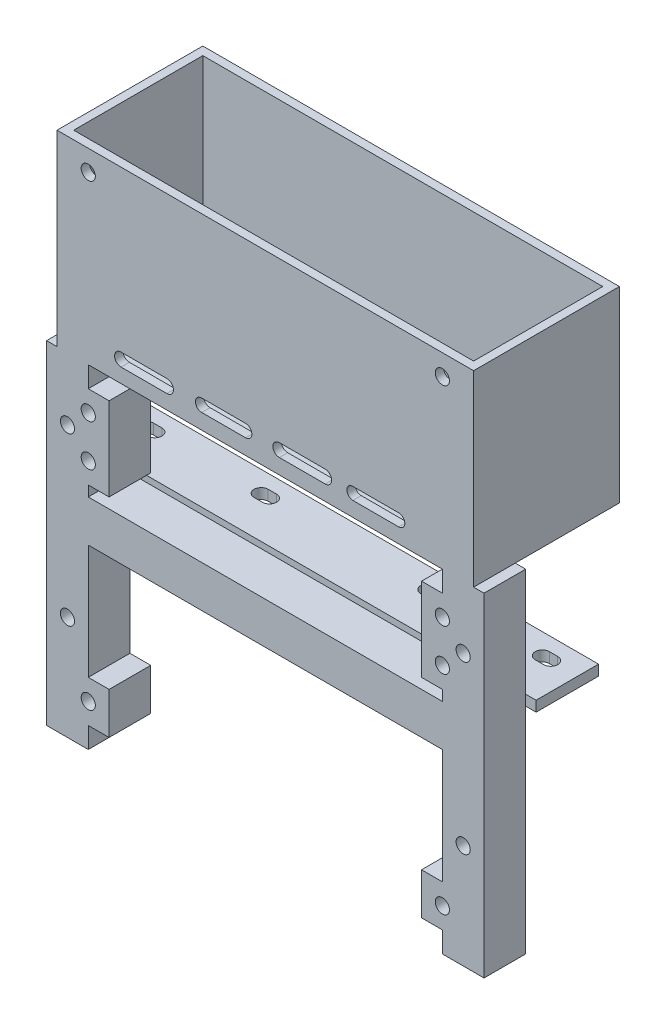
from build123d import *

# Parameters (mm, degrees)
V3_BOX_FOOTPRINT_100_X_45_MM_W                 = 100
V3_BOX_FOOTPRINT_100_X_45_MM_H                 = 45
V3_BOX_HEIGHT_35_MM_DEPTH                      = 35
V3_REAR_OPENING_96_X_31_MM_W                   = 96
V3_REAR_OPENING_96_X_31_MM_H                   = 31
V3_CAVITY_ALL_WALLS_2_MM_DEPTH                 = 43
V3_SQUARE_BEAMS_10_X_10_PITCH_95_MM_W          = 10
V3_SQUARE_BEAMS_10_X_10_PITCH_95_MM_H          = 10
V3_FORWARD_BEAM_LENGTH_65_MM_DEPTH             = 65
V3_LEFT_PCB_EAR_PROFILE_W                      = 10
V3_LEFT_PCB_EAR_PROFILE_H                      = 10
V3_LEFT_INWARD_EAR_5_MM_DEPTH                  = 5
V3_RIGHT_PCB_EAR_PROFILE_W                     = 10
V3_RIGHT_PCB_EAR_PROFILE_H                     = 10
V3_RIGHT_INWARD_EAR_5_MM_DEPTH                 = 5
V3_PCB_ROOF_PAIR_PITCH_85_MM_R                 = 1.7
V3_M3_ROOF_HOLES_DIAMETER_3_4_MM_DEPTH         = 2
V3_PCB_FORWARD_PAIR_ROW_SPACING_60_MM_R        = 1.7
V3_M3_PCB_EAR_HOLES_DEPTH                      = 10
V3_CHASSIS_TOP_HOLES_WIDTH_95_DEPTH_40_M_R     = 1.7
V3_M3_BEAM_TOP_BOTTOM_HOLES_DEPTH              = 10
V3_HANGING_PLATE_OFFSET_26_THICKNESS_2_5_W     = 110
V3_HANGING_PLATE_OFFSET_26_THICKNESS_2_5_H     = 2.5
V3_MOUNTING_PLATE_DOWNWARD_15_MM_WIDTH_1_DEPTH = 15
FOUR_HORIZONTAL_SLOTS_3_4_X_5_4_MM_DEPTH       = 2.5
CUT_EXTRUDE_1_DEPTH                            = 93.059763198
H_CROSSMEMBER_10_X_10_MM_AT_BEAM_MIDPOIN_W     = 10
H_CROSSMEMBER_10_X_10_MM_AT_BEAM_MIDPOIN_H     = 10
H_CROSSMEMBER_85_MM_DEPTH                      = 85
LONGITUDINAL_START                             = -2
BEAM_CAVITIES_6_MM_WIDE_PRESERVING_SCREW_W     = 6
BEAM_CAVITIES_6_MM_WIDE_PRESERVING_SCREW_H     = 6
BEAM_CAVITIES_6_MM_WIDE_PRESERVING_SCREW_H_2   = 27
BEAM_CAVITIES_6_MM_WIDE_PRESERVING_SCREW_H_3   = 9
LONGITUDINAL_BEAM_WALLS_2_MM_INNER_HEI_DEPTH   = 6
H_START                                        = -2
H_CROSSMEMBER_CAVITY_CONNECTS_BOTH_BEAM_W      = 89
H_CROSSMEMBER_CAVITY_CONNECTS_BOTH_BEAM_H      = 6
H_CROSSMEMBER_WALLS_2_MM_DEPTH                 = 6
CUT_EXTRUDE_4_DEPTH                            = 93.059763198
V6_EXTEND_10_X_10_HOLLOW_BEAMS_WITH_2_MM_W     = 10
V6_EXTEND_10_X_10_HOLLOW_BEAMS_WITH_2_MM_H     = 10
V6_EXTEND_10_X_10_HOLLOW_BEAMS_WITH_2_MM_W_2   = 6
V6_EXTEND_10_X_10_HOLLOW_BEAMS_WITH_2_MM_H_2   = 6
V6_HOLLOW_BEAM_EXTENSIONS_15_MM_DEPTH          = 15
V6_FOUR_FULL_DEPTH_PCB_PADS_CENTERS_X42_W      = 15
V6_FOUR_FULL_DEPTH_PCB_PADS_CENTERS_X42_H      = 10
V6_SOLID_SCREW_PADS_WITH_5_MM_INWARD_EAR_DEPTH = 10
V6_PCB_HOLES_85_X_60_MM_AND_RETAINED_CHA_R     = 1.7
V6_FOUR_PCB_M3_HOLES_THROUGH_REINFORCED_DEPTH  = 10
V7_RETAIN_RAIL_ENVELOPES_10_X_10_LENGTH_W      = 10
V7_RETAIN_RAIL_ENVELOPES_10_X_10_LENGTH_H      = 80
V7_SOLID_LONGITUDINAL_BEAMS_DEPTH              = 10
V7_RETAIN_H_CROSSMEMBER_ENVELOPE_W             = 85
V7_RETAIN_H_CROSSMEMBER_ENVELOPE_H             = 10
V7_SOLID_H_CROSSMEMBER_DEPTH                   = 10
V7_PRESERVE_ALL_TEN_EXISTING_BEAM_M3_BOR_R     = 1.7
V7_RESTORE_CHASSIS_AND_PCB_CLEARANCE_BOR_DEPTH = 10
V7_REFILL_OLD_MOUNTING_SLOTS_WITHIN_UNCH_W     = 110
V7_REFILL_OLD_MOUNTING_SLOTS_WITHIN_UNCH_H     = 15
V7_CLOSE_PREVIOUS_SLOT_POSITIONS_DEPTH         = 2.5
V7_FOUR_HORIZONTAL_SLOTS_3_4_X_5_4_MM_AT_DEPTH = 2.5


with BuildPart() as part:
    # V3 box footprint 100 x 45 mm → V3 box height 35 mm (new body)
    with BuildSketch(Plane.XY):
        with Locations((0, 22.5)):
            Rectangle(V3_BOX_FOOTPRINT_100_X_45_MM_W, V3_BOX_FOOTPRINT_100_X_45_MM_H)
    extrude(amount=V3_BOX_HEIGHT_35_MM_DEPTH)

    # V3 rear opening 96 x 31 mm → V3 cavity all walls 2 mm (cut)
    with BuildSketch(Plane(origin=(0, 45, 0), x_dir=(1, 0, 0), z_dir=(0, 1, 0))):
        with Locations((0, -17.5)):
            Rectangle(V3_REAR_OPENING_96_X_31_MM_W, V3_REAR_OPENING_96_X_31_MM_H)
    extrude(amount=-V3_CAVITY_ALL_WALLS_2_MM_DEPTH, mode=Mode.SUBTRACT)

    # V3 square beams 10 x 10 pitch 95 mm → V3 forward beam length 65 mm (add)
    with BuildSketch(Plane.XZ):
        with Locations((-47.5, 30)):
            Rectangle(V3_SQUARE_BEAMS_10_X_10_PITCH_95_MM_W, V3_SQUARE_BEAMS_10_X_10_PITCH_95_MM_H)
        with Locations((47.5, 30)):
            Rectangle(V3_SQUARE_BEAMS_10_X_10_PITCH_95_MM_W, V3_SQUARE_BEAMS_10_X_10_PITCH_95_MM_H)
    extrude(amount=V3_FORWARD_BEAM_LENGTH_65_MM_DEPTH)

    # V3 left PCB ear profile → V3 left inward ear 5 mm (add)
    with BuildSketch(Plane(origin=(-42.5, 0, 0), x_dir=(0, 0, -1), z_dir=(1, 0, 0))):
        with Locations((-30, -20)):
            Rectangle(V3_LEFT_PCB_EAR_PROFILE_W, V3_LEFT_PCB_EAR_PROFILE_H)
    extrude(amount=V3_LEFT_INWARD_EAR_5_MM_DEPTH)

    # V3 right PCB ear profile → V3 right inward ear 5 mm (add)
    with BuildSketch(Plane.ZY.offset(-42.5)):
        with Locations((30, -20)):
            Rectangle(V3_RIGHT_PCB_EAR_PROFILE_W, V3_RIGHT_PCB_EAR_PROFILE_H)
    extrude(amount=V3_RIGHT_INWARD_EAR_5_MM_DEPTH)

    # V3 PCB roof pair pitch 85 mm → V3 M3 roof holes diameter 3.4 mm (cut)
    with BuildSketch(Plane.XY.offset(35)):
        with Locations((-42.5, 40)):
            Circle(V3_PCB_ROOF_PAIR_PITCH_85_MM_R)
        with Locations((42.5, 40)):
            Circle(V3_PCB_ROOF_PAIR_PITCH_85_MM_R)
    extrude(amount=-V3_M3_ROOF_HOLES_DIAMETER_3_4_MM_DEPTH, mode=Mode.SUBTRACT)

    # V3 PCB forward pair row spacing 60 mm → V3 M3 PCB ear holes (cut)
    with BuildSketch(Plane.XY.offset(35)):
        with Locations((-42.5, -20)):
            Circle(V3_PCB_FORWARD_PAIR_ROW_SPACING_60_MM_R)
        with Locations((42.5, -20)):
            Circle(V3_PCB_FORWARD_PAIR_ROW_SPACING_60_MM_R)
    extrude(amount=-V3_M3_PCB_EAR_HOLES_DEPTH, mode=Mode.SUBTRACT)

    # V3 chassis top holes width 95 depth 40 mm → V3 M3 beam top bottom holes (cut)
    with BuildSketch(Plane.XY.offset(35)):
        with Locations((-47.5, -55)):
            Circle(V3_CHASSIS_TOP_HOLES_WIDTH_95_DEPTH_40_M_R)
        with Locations((-47.5, -15)):
            Circle(V3_CHASSIS_TOP_HOLES_WIDTH_95_DEPTH_40_M_R)
        with Locations((47.5, -55)):
            Circle(V3_CHASSIS_TOP_HOLES_WIDTH_95_DEPTH_40_M_R)
        with Locations((47.5, -15)):
            Circle(V3_CHASSIS_TOP_HOLES_WIDTH_95_DEPTH_40_M_R)
    extrude(amount=-V3_M3_BEAM_TOP_BOTTOM_HOLES_DEPTH, mode=Mode.SUBTRACT)

    # V3 hanging plate offset 26 thickness 2.5 mm → V3 mounting plate downward 15 mm width 110 (add)
    with BuildSketch(Plane(origin=(0, 0, 25), x_dir=(-1, 0, 0), z_dir=(0, 0, -1))):
        with Locations((0, -27.25)):
            Rectangle(V3_HANGING_PLATE_OFFSET_26_THICKNESS_2_5_W, V3_HANGING_PLATE_OFFSET_26_THICKNESS_2_5_H)
    extrude(amount=V3_MOUNTING_PLATE_DOWNWARD_15_MM_WIDTH_1_DEPTH)

    # V3 slots 6 mm below beam underside centers 20 and 47.5 → Four horizontal slots 3.4 x 5.4 mm (cut)
    with BuildSketch(Plane.XZ.offset(28.5)):
        with BuildLine():
            Line((-48.5, 20.7), (-46.5, 20.7))
            ThreePointArc((-46.5, 20.7), (-44.8, 19), (-46.5, 17.3))
            Line((-46.5, 17.3), (-48.5, 17.3))
            ThreePointArc((-48.5, 17.3), (-50.2, 19), (-48.5, 20.7))
        make_face()
        with BuildLine():
            Line((-21, 20.7), (-19, 20.7))
            ThreePointArc((-19, 20.7), (-17.3, 19), (-19, 17.3))
            Line((-19, 17.3), (-21, 17.3))
            ThreePointArc((-21, 17.3), (-22.7, 19), (-21, 20.7))
        make_face()
        with BuildLine():
            Line((19, 20.7), (21, 20.7))
            ThreePointArc((21, 20.7), (22.7, 19), (21, 17.3))
            Line((21, 17.3), (19, 17.3))
            ThreePointArc((19, 17.3), (17.3, 19), (19, 20.7))
        make_face()
        with BuildLine():
            Line((46.5, 20.7), (48.5, 20.7))
            ThreePointArc((48.5, 20.7), (50.2, 19), (48.5, 17.3))
            Line((48.5, 17.3), (46.5, 17.3))
            ThreePointArc((46.5, 17.3), (44.8, 19), (46.5, 20.7))
        make_face()
    extrude(amount=-FOUR_HORIZONTAL_SLOTS_3_4_X_5_4_MM_DEPTH, mode=Mode.SUBTRACT)

    # 草图2 → 切除-拉伸1 (cut, through all)
    with BuildSketch(Plane(origin=(0, 0, 0), x_dir=(-1, 0, 0), z_dir=(0, 0, -1))):
        with BuildLine():
            Line((-32.029979042, 6.459471041), (-21.029979042, 6.459471041))
            ThreePointArc((-21.029979042, 6.459471041), (-19.570508001, 5), (-21.029979042, 3.540528959))
            Line((-21.029979042, 3.540528959), (-32.029979042, 3.540528959))
            ThreePointArc((-32.029979042, 3.540528959), (-33.489450083, 5), (-32.029979042, 6.459471041))
        make_face()
        with BuildLine():
            Line((23.620107008, 6.558669056), (34.620107008, 6.558669056))
            ThreePointArc((34.620107008, 6.558669056), (36.178776063, 5), (34.620107008, 3.441330944))
            Line((34.620107008, 3.441330944), (23.620107008, 3.441330944))
            ThreePointArc((23.620107008, 3.441330944), (22.061437952, 5), (23.620107008, 6.558669056))
        make_face()
    extrude(amount=-CUT_EXTRUDE_1_DEPTH, mode=Mode.SUBTRACT)

    # H crossmember 10 x 10 mm at beam midpoint → H crossmember 85 mm (add)
    with BuildSketch(Plane(origin=(-42.5, 0, 0), x_dir=(0, 0, -1), z_dir=(1, 0, 0))):
        with Locations((-30, -32.5)):
            Rectangle(H_CROSSMEMBER_10_X_10_MM_AT_BEAM_MIDPOIN_W, H_CROSSMEMBER_10_X_10_MM_AT_BEAM_MIDPOIN_H)
    extrude(amount=H_CROSSMEMBER_85_MM_DEPTH)

    # Beam cavities 6 mm wide preserving screw collars → Longitudinal beam walls 2 mm - inner height 6 mm (cut)
    with BuildSketch(Plane.XY.offset(35).offset(LONGITUDINAL_START)):
        with Locations((-47.5, -62)):
            Rectangle(BEAM_CAVITIES_6_MM_WIDE_PRESERVING_SCREW_W, BEAM_CAVITIES_6_MM_WIDE_PRESERVING_SCREW_H)
        with Locations((-47.5, -37.5)):
            Rectangle(BEAM_CAVITIES_6_MM_WIDE_PRESERVING_SCREW_W, BEAM_CAVITIES_6_MM_WIDE_PRESERVING_SCREW_H_2)
        with Locations((-47.5, -6.5)):
            Rectangle(BEAM_CAVITIES_6_MM_WIDE_PRESERVING_SCREW_W, BEAM_CAVITIES_6_MM_WIDE_PRESERVING_SCREW_H_3)
        with Locations((47.5, -62)):
            Rectangle(BEAM_CAVITIES_6_MM_WIDE_PRESERVING_SCREW_W, BEAM_CAVITIES_6_MM_WIDE_PRESERVING_SCREW_H)
        with Locations((47.5, -37.5)):
            Rectangle(BEAM_CAVITIES_6_MM_WIDE_PRESERVING_SCREW_W, BEAM_CAVITIES_6_MM_WIDE_PRESERVING_SCREW_H_2)
        with Locations((47.5, -6.5)):
            Rectangle(BEAM_CAVITIES_6_MM_WIDE_PRESERVING_SCREW_W, BEAM_CAVITIES_6_MM_WIDE_PRESERVING_SCREW_H_3)
    extrude(amount=-LONGITUDINAL_BEAM_WALLS_2_MM_INNER_HEI_DEPTH, mode=Mode.SUBTRACT)

    # H crossmember cavity connects both beam cavities → H crossmember walls 2 mm (cut)
    with BuildSketch(Plane.XY.offset(35).offset(H_START)):
        with Locations((0, -32.5)):
            Rectangle(H_CROSSMEMBER_CAVITY_CONNECTS_BOTH_BEAM_W, H_CROSSMEMBER_CAVITY_CONNECTS_BOTH_BEAM_H)
    extrude(amount=-H_CROSSMEMBER_WALLS_2_MM_DEPTH, mode=Mode.SUBTRACT)

    # 草图8 → 切除-拉伸4 (cut, through all)
    with BuildSketch(Plane(origin=(0, 0, 0), x_dir=(-1, 0, 0), z_dir=(0, 0, -1))):
        with BuildLine():
            Line((-14.372732488, 6.733005515), (-3.372732488, 6.733005515))
            ThreePointArc((-3.372732488, 6.733005515), (-1.826093217, 5.186366244), (-3.372732488, 3.639726973))
            Line((-3.372732488, 3.639726973), (-14.372732488, 3.639726973))
            ThreePointArc((-14.372732488, 3.639726973), (-15.919371759, 5.186366244), (-14.372732488, 6.733005515))
        make_face()
        with BuildLine():
            Line((4.72350579, 6.686366244), (15.27649421, 6.686366244))
            ThreePointArc((15.27649421, 6.686366244), (16.77649421, 5.186366244), (15.27649421, 3.686366244))
            Line((15.27649421, 3.686366244), (4.72350579, 3.686366244))
            ThreePointArc((4.72350579, 3.686366244), (3.22350579, 5.186366244), (4.72350579, 6.686366244))
        make_face()
    extrude(amount=-CUT_EXTRUDE_4_DEPTH, mode=Mode.SUBTRACT)

    # V6 extend 10 x 10 hollow beams with 2 mm walls → V6 hollow beam extensions 15 mm (add)
    # profile 1 of 2: a face of its own
    with BuildSketch(Plane.XZ.offset(65)):
        with Locations((-47.5, 30)):
            Rectangle(V6_EXTEND_10_X_10_HOLLOW_BEAMS_WITH_2_MM_W, V6_EXTEND_10_X_10_HOLLOW_BEAMS_WITH_2_MM_H)
        with Locations((-47.5, 30)):
            Rectangle(V6_EXTEND_10_X_10_HOLLOW_BEAMS_WITH_2_MM_W_2, V6_EXTEND_10_X_10_HOLLOW_BEAMS_WITH_2_MM_H_2, mode=Mode.SUBTRACT)
    # profile 2 of 2: a face of its own
    with BuildSketch(Plane.XZ.offset(65)):
        with Locations((47.5, 30)):
            Rectangle(V6_EXTEND_10_X_10_HOLLOW_BEAMS_WITH_2_MM_W, V6_EXTEND_10_X_10_HOLLOW_BEAMS_WITH_2_MM_H)
        with Locations((47.5, 30)):
            Rectangle(V6_EXTEND_10_X_10_HOLLOW_BEAMS_WITH_2_MM_W_2, V6_EXTEND_10_X_10_HOLLOW_BEAMS_WITH_2_MM_H_2, mode=Mode.SUBTRACT)
    extrude(amount=V6_HOLLOW_BEAM_EXTENSIONS_15_MM_DEPTH)

    # V6 four full-depth PCB pads centers x42.5 y-70 and -10 → V6 solid screw pads with 5 mm inward ears (add)
    with BuildSketch(Plane.XY.offset(35)):
        with Locations((-45, -70)):
            Rectangle(V6_FOUR_FULL_DEPTH_PCB_PADS_CENTERS_X42_W, V6_FOUR_FULL_DEPTH_PCB_PADS_CENTERS_X42_H)
        with Locations((45, -70)):
            Rectangle(V6_FOUR_FULL_DEPTH_PCB_PADS_CENTERS_X42_W, V6_FOUR_FULL_DEPTH_PCB_PADS_CENTERS_X42_H)
        with Locations((-45, -10)):
            Rectangle(V6_FOUR_FULL_DEPTH_PCB_PADS_CENTERS_X42_W, V6_FOUR_FULL_DEPTH_PCB_PADS_CENTERS_X42_H)
        with Locations((45, -10)):
            Rectangle(V6_FOUR_FULL_DEPTH_PCB_PADS_CENTERS_X42_W, V6_FOUR_FULL_DEPTH_PCB_PADS_CENTERS_X42_H)
    extrude(amount=-V6_SOLID_SCREW_PADS_WITH_5_MM_INWARD_EAR_DEPTH)

    # V6 PCB holes 85 x 60 mm and retained chassis holes → V6 four PCB M3 holes through reinforced beam pads (cut)
    with BuildSketch(Plane.XY.offset(35)):
        with Locations((-42.5, -70)):
            Circle(V6_PCB_HOLES_85_X_60_MM_AND_RETAINED_CHA_R)
        with Locations((-42.5, -10)):
            Circle(V6_PCB_HOLES_85_X_60_MM_AND_RETAINED_CHA_R)
        with Locations((42.5, -70)):
            Circle(V6_PCB_HOLES_85_X_60_MM_AND_RETAINED_CHA_R)
        with Locations((42.5, -10)):
            Circle(V6_PCB_HOLES_85_X_60_MM_AND_RETAINED_CHA_R)
        with Locations((-47.5, -15)):
            Circle(V6_PCB_HOLES_85_X_60_MM_AND_RETAINED_CHA_R)
        with Locations((47.5, -15)):
            Circle(V6_PCB_HOLES_85_X_60_MM_AND_RETAINED_CHA_R)
    extrude(amount=-V6_FOUR_PCB_M3_HOLES_THROUGH_REINFORCED_DEPTH, mode=Mode.SUBTRACT)

    # V7 retain rail envelopes 10 x 10 length 80 mm → V7 solid longitudinal beams (add)
    with BuildSketch(Plane.XY.offset(35)):
        with Locations((-47.5, -40)):
            Rectangle(V7_RETAIN_RAIL_ENVELOPES_10_X_10_LENGTH_W, V7_RETAIN_RAIL_ENVELOPES_10_X_10_LENGTH_H)
        with Locations((47.5, -40)):
            Rectangle(V7_RETAIN_RAIL_ENVELOPES_10_X_10_LENGTH_W, V7_RETAIN_RAIL_ENVELOPES_10_X_10_LENGTH_H)
    extrude(amount=-V7_SOLID_LONGITUDINAL_BEAMS_DEPTH)

    # V7 retain H crossmember envelope → V7 solid H crossmember (add)
    with BuildSketch(Plane.XY.offset(35)):
        with Locations((0, -32.5)):
            Rectangle(V7_RETAIN_H_CROSSMEMBER_ENVELOPE_W, V7_RETAIN_H_CROSSMEMBER_ENVELOPE_H)
    extrude(amount=-V7_SOLID_H_CROSSMEMBER_DEPTH)

    # V7 preserve all ten existing beam M3 bores → V7 restore chassis and PCB clearance bores (cut)
    with BuildSketch(Plane.XY.offset(35)):
        with Locations((-47.5, -55)):
            Circle(V7_PRESERVE_ALL_TEN_EXISTING_BEAM_M3_BOR_R)
        with Locations((-47.5, -15)):
            Circle(V7_PRESERVE_ALL_TEN_EXISTING_BEAM_M3_BOR_R)
        with Locations((47.5, -55)):
            Circle(V7_PRESERVE_ALL_TEN_EXISTING_BEAM_M3_BOR_R)
        with Locations((47.5, -15)):
            Circle(V7_PRESERVE_ALL_TEN_EXISTING_BEAM_M3_BOR_R)
        with Locations((-42.5, -70)):
            Circle(V7_PRESERVE_ALL_TEN_EXISTING_BEAM_M3_BOR_R)
        with Locations((-42.5, -20)):
            Circle(V7_PRESERVE_ALL_TEN_EXISTING_BEAM_M3_BOR_R)
        with Locations((-42.5, -10)):
            Circle(V7_PRESERVE_ALL_TEN_EXISTING_BEAM_M3_BOR_R)
        with Locations((42.5, -70)):
            Circle(V7_PRESERVE_ALL_TEN_EXISTING_BEAM_M3_BOR_R)
        with Locations((42.5, -20)):
            Circle(V7_PRESERVE_ALL_TEN_EXISTING_BEAM_M3_BOR_R)
        with Locations((42.5, -10)):
            Circle(V7_PRESERVE_ALL_TEN_EXISTING_BEAM_M3_BOR_R)
    extrude(amount=-V7_RESTORE_CHASSIS_AND_PCB_CLEARANCE_BOR_DEPTH, mode=Mode.SUBTRACT)

    # V7 refill old mounting slots within unchanged plate → V7 close previous slot positions (add)
    with BuildSketch(Plane.XZ.offset(28.5)):
        with Locations((0, 17.5)):
            Rectangle(V7_REFILL_OLD_MOUNTING_SLOTS_WITHIN_UNCH_W, V7_REFILL_OLD_MOUNTING_SLOTS_WITHIN_UNCH_H)
    extrude(amount=-V7_CLOSE_PREVIOUS_SLOT_POSITIONS_DEPTH)

    # V7 slot centers z15 - 10 mm below beam underside z25 → V7 four horizontal slots 3.4 x 5.4 mm at 10 mm (cut)
    with BuildSketch(Plane.XZ.offset(28.5)):
        with BuildLine():
            Line((-48.5, 16.7), (-46.5, 16.7))
            ThreePointArc((-46.5, 16.7), (-44.8, 15), (-46.5, 13.3))
            Line((-46.5, 13.3), (-48.5, 13.3))
            ThreePointArc((-48.5, 13.3), (-50.2, 15), (-48.5, 16.7))
        make_face()
        with BuildLine():
            Line((-21, 16.7), (-19, 16.7))
            ThreePointArc((-19, 16.7), (-17.3, 15), (-19, 13.3))
            Line((-19, 13.3), (-21, 13.3))
            ThreePointArc((-21, 13.3), (-22.7, 15), (-21, 16.7))
        make_face()
        with BuildLine():
            Line((19, 16.7), (21, 16.7))
            ThreePointArc((21, 16.7), (22.7, 15), (21, 13.3))
            Line((21, 13.3), (19, 13.3))
            ThreePointArc((19, 13.3), (17.3, 15), (19, 16.7))
        make_face()
        with BuildLine():
            Line((46.5, 16.7), (48.5, 16.7))
            ThreePointArc((48.5, 16.7), (50.2, 15), (48.5, 13.3))
            Line((48.5, 13.3), (46.5, 13.3))
            ThreePointArc((46.5, 13.3), (44.8, 15), (46.5, 16.7))
        make_face()
    extrude(amount=-V7_FOUR_HORIZONTAL_SLOTS_3_4_X_5_4_MM_AT_DEPTH, mode=Mode.SUBTRACT)


solid = part.part
